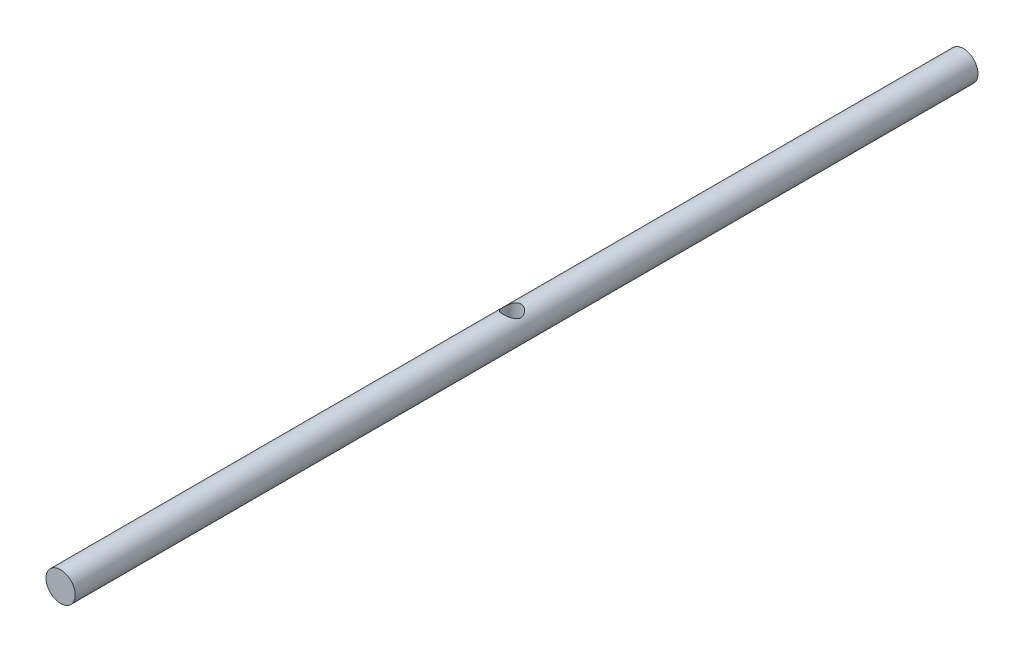
from build123d import *

# Parameters (mm, degrees)
ESBO_O1_R                = 6.255
RESSALTO_EXTRUS_O1_DEPTH = 386
ESBO_O2_R                = 3.8315
CORTE_EXTRUS_O1_DEPTH    = 387.39274068


with BuildPart() as part:
    # Esboço1 → Ressalto-extrusão1 (new body)
    with BuildSketch(Plane.XY):
        Circle(ESBO_O1_R)
    extrude(amount=RESSALTO_EXTRUS_O1_DEPTH)

    # Esboço2 → Corte-extrusão1 (cut, through all)
    with BuildSketch(Plane(origin=(0, 10, 0), x_dir=(1, 0, 0), z_dir=(0, 1, 0))):
        with Locations(Location((-0.0205, -193, 0), (0, 0, 270))):
            Circle(ESBO_O2_R)
    extrude(amount=-CORTE_EXTRUS_O1_DEPTH, mode=Mode.SUBTRACT)


solid = part.part
